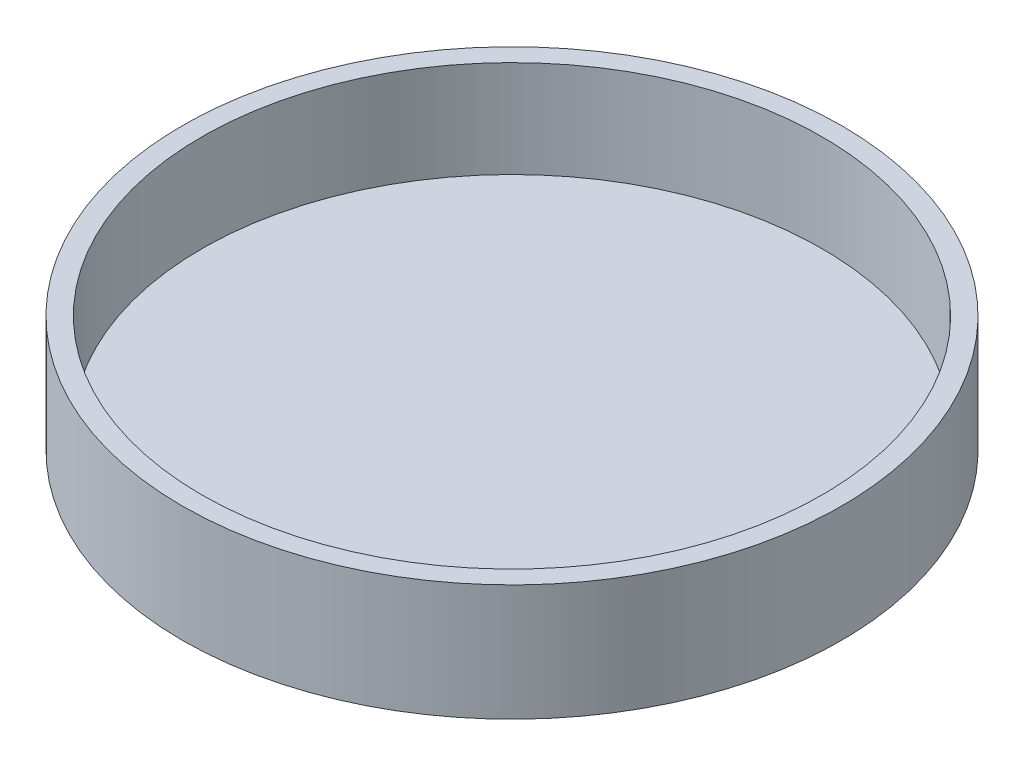
from build123d import *

# Parameters (mm, degrees)
SKETCH1_R           = 34
SKETCH1_R_2         = 32
BOSS_EXTRUDE1_DEPTH = 12
SKETCH1_2_R         = 34
SKETCH1_2_R_2       = 32
BOSS_EXTRUDE2_DEPTH = 12
SKETCH1_3_R         = 32
BOSS_EXTRUDE3_DEPTH = 2


with BuildPart() as part:
    # Sketch1 → Boss-Extrude1 (new body)
    with BuildSketch(Plane(origin=(0, 0, 0), x_dir=(1, 0, 0), z_dir=(0, 1, 0))):
        Circle(SKETCH1_R)
        Circle(SKETCH1_R_2, mode=Mode.SUBTRACT)
    extrude(amount=BOSS_EXTRUDE1_DEPTH)

    # Sketch1<2> → Boss-Extrude2 (add)
    with BuildSketch(Plane(origin=(0, 0, 0), x_dir=(1, 0, 0), z_dir=(0, 1, 0))):
        Circle(SKETCH1_2_R)
        Circle(SKETCH1_2_R_2, mode=Mode.SUBTRACT)
    extrude(amount=BOSS_EXTRUDE2_DEPTH)

    # Sketch1<3> → Boss-Extrude3 (add)
    with BuildSketch(Plane(origin=(0, 0, 0), x_dir=(1, 0, 0), z_dir=(0, 1, 0))):
        Circle(SKETCH1_3_R)
    extrude(amount=BOSS_EXTRUDE3_DEPTH)


solid = part.part
